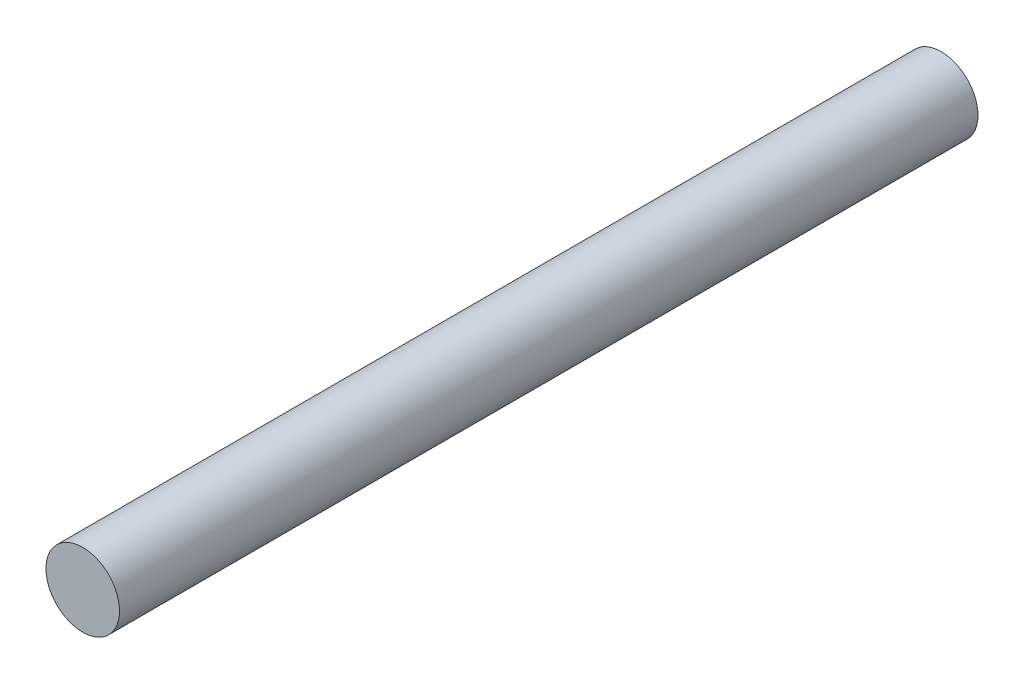
from build123d import *

# Parameters (mm, degrees)
SZKIC2_R                    = 3
DODANIE_WYCI_GNI_CIE1_DEPTH = 70


with BuildPart() as part:
    # Szkic2 → Dodanie-wyciągnięcie1 (new body)
    with BuildSketch(Plane.XY):
        Circle(SZKIC2_R)
    extrude(amount=DODANIE_WYCI_GNI_CIE1_DEPTH)


solid = part.part
